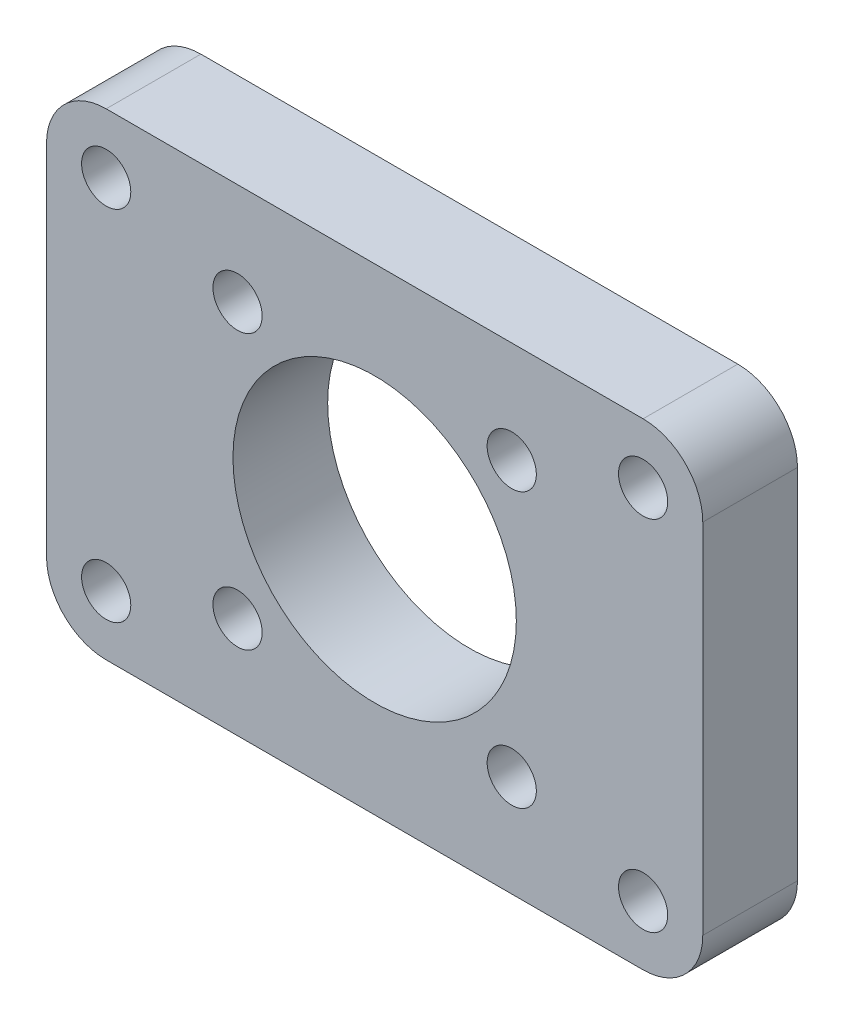
from build123d import *

# Parameters (mm, degrees)
SKETCH1_W           = 44
SKETCH1_H           = 32
SKETCH1_R           = 9.5
SKETCH1_R_2         = 1.65
BOSS_EXTRUDE1_DEPTH = 6.35
SKETCH2_R           = 1.65
CUT_EXTRUDE1_DEPTH  = 28.934253167
FILLET1_R           = 4


with BuildPart() as part:
    # Sketch1 → Boss-Extrude1 (new body)
    with BuildSketch(Plane.XY):
        Rectangle(SKETCH1_W, SKETCH1_H)
        Circle(SKETCH1_R, mode=Mode.SUBTRACT)
        with Locations((-9.192388155, 9.192388155)):
            Circle(SKETCH1_R_2, mode=Mode.SUBTRACT)
        with Locations((9.192388155, 9.192388155)):
            Circle(SKETCH1_R_2, mode=Mode.SUBTRACT)
        with Locations((9.192388155, -9.192388155)):
            Circle(SKETCH1_R_2, mode=Mode.SUBTRACT)
        with Locations((-9.192388155, -9.192388155)):
            Circle(SKETCH1_R_2, mode=Mode.SUBTRACT)
    extrude(amount=BOSS_EXTRUDE1_DEPTH)

    # Sketch2 → Cut-Extrude1 (cut, through all)
    with BuildSketch(Plane.XY.offset(6.35)):
        with Locations((-18, 12)):
            Circle(SKETCH2_R)
        with Locations((-18, -12)):
            Circle(SKETCH2_R)
        with Locations((18, -12)):
            Circle(SKETCH2_R)
        with Locations((18, 12)):
            Circle(SKETCH2_R)
    extrude(amount=-CUT_EXTRUDE1_DEPTH, mode=Mode.SUBTRACT)

    # Fillet1
    fillet1_edges = [part.edges().sort_by_distance(p)[0] for p in [
        (-22, 16, 3.175),
        (22, 16, 3.175),
        (22, -16, 3.175),
        (-22, -16, 3.175),
    ]]
    fillet(fillet1_edges, radius=FILLET1_R)


solid = part.part
